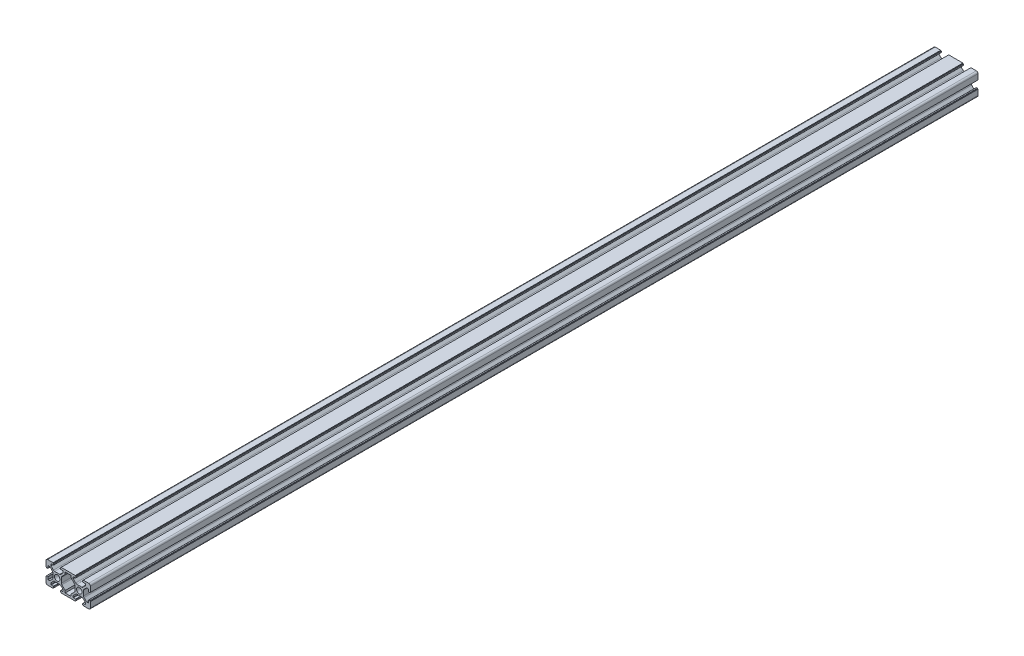
from build123d import *

# Parameters (mm, degrees)
SKETCH_1_R      = 2.5
EXTRUDE_1_DEPTH = 800


with BuildPart() as part:
    # 草图1 → 凸台-拉伸1 (new body)
    with BuildSketch(Plane.XY):
        with BuildLine():
            Line((-0.771587854, 9.545792426), (-5.671587854, 9.545792426))
            Line((-5.671587854, 9.545792426), (-5.671587854, 9.245792426))
            ThreePointArc((-5.671587854, 9.245792426), (-5.730166498, 9.10437107), (-5.871587854, 9.045792426))
            Line((-5.871587854, 9.045792426), (-6.171587854, 9.045792426))
            Line((-6.171587854, 9.045792426), (-6.171587854, 8.045792426))
            ThreePointArc((-6.171587854, 8.045792426), (-6.083719889, 7.833660392), (-5.871587854, 7.745792426))
            Line((-5.871587854, 7.745792426), (-4.071587854, 7.745792426))
            ThreePointArc((-4.071587854, 7.745792426), (-3.85945582, 7.657924461), (-3.771587854, 7.445792426))
            Line((-3.771587854, 7.445792426), (-3.771587854, 6.105792426))
            Line((-3.771587854, 6.105792426), (-5.992248026, 3.885132255))
            ThreePointArc((-5.992248026, 3.885132255), (-6.478883049, 3.559973128), (-7.052908198, 3.445792426))
            Line((-7.052908198, 3.445792426), (-11.490267511, 3.445792426))
            ThreePointArc((-11.490267511, 3.445792426), (-12.064292659, 3.559973128), (-12.550927682, 3.885132255))
            Line((-12.550927682, 3.885132255), (-14.771587854, 6.105792426))
            Line((-14.771587854, 6.105792426), (-14.771587854, 7.445792426))
            ThreePointArc((-14.771587854, 7.445792426), (-14.683719889, 7.657924461), (-14.471587854, 7.745792426))
            Line((-14.471587854, 7.745792426), (-12.671587854, 7.745792426))
            ThreePointArc((-12.671587854, 7.745792426), (-12.45945582, 7.833660392), (-12.371587854, 8.045792426))
            Line((-12.371587854, 8.045792426), (-12.371587854, 9.045792426))
            Line((-12.371587854, 9.045792426), (-12.671587854, 9.045792426))
            ThreePointArc((-12.671587854, 9.045792426), (-12.81300921, 9.10437107), (-12.871587854, 9.245792426))
            Line((-12.871587854, 9.245792426), (-12.871587854, 9.545792426))
            Line((-12.871587854, 9.545792426), (-17.771587854, 9.545792426))
            ThreePointArc((-17.771587854, 9.545792426), (-18.832248026, 9.106452598), (-19.271587854, 8.045792426))
            Line((-19.271587854, 8.045792426), (-19.271587854, 3.145792426))
            Line((-19.271587854, 3.145792426), (-18.971587854, 3.145792426))
            ThreePointArc((-18.971587854, 3.145792426), (-18.830166498, 3.087213783), (-18.771587854, 2.945792426))
            Line((-18.771587854, 2.945792426), (-18.771587854, 2.645792426))
            Line((-18.771587854, 2.645792426), (-17.771587854, 2.645792426))
            ThreePointArc((-17.771587854, 2.645792426), (-17.55945582, 2.733660392), (-17.471587854, 2.945792426))
            Line((-17.471587854, 2.945792426), (-17.471587854, 4.745792426))
            ThreePointArc((-17.471587854, 4.745792426), (-17.383719889, 4.957924461), (-17.171587854, 5.045792426))
            Line((-17.171587854, 5.045792426), (-15.831587854, 5.045792426))
            Line((-15.831587854, 5.045792426), (-13.610927682, 2.825132255))
            ThreePointArc((-13.610927682, 2.825132255), (-13.285768555, 2.338497231), (-13.171587854, 1.764472083))
            Line((-13.171587854, 1.764472083), (-13.171587854, -2.67288723))
            ThreePointArc((-13.171587854, -2.67288723), (-13.285768555, -3.246912379), (-13.610927682, -3.733547402))
            Line((-13.610927682, -3.733547402), (-15.831587854, -5.954207574))
            Line((-15.831587854, -5.954207574), (-17.171587854, -5.954207574))
            ThreePointArc((-17.171587854, -5.954207574), (-17.383719889, -5.866339608), (-17.471587854, -5.654207574))
            Line((-17.471587854, -5.654207574), (-17.471587854, -3.854207574))
            ThreePointArc((-17.471587854, -3.854207574), (-17.55945582, -3.642075539), (-17.771587854, -3.554207574))
            Line((-17.771587854, -3.554207574), (-18.771587854, -3.554207574))
            Line((-18.771587854, -3.554207574), (-18.771587854, -3.854207574))
            ThreePointArc((-18.771587854, -3.854207574), (-18.830166498, -3.99562893), (-18.971587854, -4.054207574))
            Line((-18.971587854, -4.054207574), (-19.271587854, -4.054207574))
            Line((-19.271587854, -4.054207574), (-19.271587854, -8.954207574))
            ThreePointArc((-19.271587854, -8.954207574), (-18.832248026, -10.014867745), (-17.771587854, -10.454207574))
            Line((-17.771587854, -10.454207574), (-12.871587854, -10.454207574))
            Line((-12.871587854, -10.454207574), (-12.871587854, -10.154207574))
            ThreePointArc((-12.871587854, -10.154207574), (-12.81300921, -10.012786217), (-12.671587854, -9.954207574))
            Line((-12.671587854, -9.954207574), (-12.371587854, -9.954207574))
            Line((-12.371587854, -9.954207574), (-12.371587854, -8.954207574))
            ThreePointArc((-12.371587854, -8.954207574), (-12.45945582, -8.742075539), (-12.671587854, -8.654207574))
            Line((-12.671587854, -8.654207574), (-14.471587854, -8.654207574))
            ThreePointArc((-14.471587854, -8.654207574), (-14.683719889, -8.566339608), (-14.771587854, -8.354207574))
            Line((-14.771587854, -8.354207574), (-14.771587854, -7.014207574))
            Line((-14.771587854, -7.014207574), (-12.550927682, -4.793547402))
            ThreePointArc((-12.550927682, -4.793547402), (-12.064292659, -4.468388275), (-11.490267511, -4.354207574))
            Line((-11.490267511, -4.354207574), (-7.052908198, -4.354207574))
            ThreePointArc((-7.052908198, -4.354207574), (-6.478883049, -4.468388275), (-5.992248026, -4.793547402))
            Line((-5.992248026, -4.793547402), (-3.771587854, -7.014207574))
            Line((-3.771587854, -7.014207574), (-3.771587854, -8.354207574))
            ThreePointArc((-3.771587854, -8.354207574), (-3.85945582, -8.566339608), (-4.071587854, -8.654207574))
            Line((-4.071587854, -8.654207574), (-5.871587854, -8.654207574))
            ThreePointArc((-5.871587854, -8.654207574), (-6.083719889, -8.742075539), (-6.171587854, -8.954207574))
            Line((-6.171587854, -8.954207574), (-6.171587854, -9.954207574))
            Line((-6.171587854, -9.954207574), (-5.871587854, -9.954207574))
            ThreePointArc((-5.871587854, -9.954207574), (-5.730166498, -10.012786217), (-5.671587854, -10.154207574))
            Line((-5.671587854, -10.154207574), (-5.671587854, -10.454207574))
            Line((-5.671587854, -10.454207574), (-0.771587854, -10.454207574))
            Line((-0.771587854, -10.454207574), (7.128412146, -10.454207574))
            Line((7.128412146, -10.454207574), (7.128412146, -10.154207574))
            ThreePointArc((7.128412146, -10.154207574), (7.18699079, -10.012786217), (7.328412146, -9.954207574))
            Line((7.328412146, -9.954207574), (7.628412146, -9.954207574))
            Line((7.628412146, -9.954207574), (7.628412146, -8.954207574))
            ThreePointArc((7.628412146, -8.954207574), (7.54054418, -8.742075539), (7.328412146, -8.654207574))
            Line((7.328412146, -8.654207574), (5.528412146, -8.654207574))
            ThreePointArc((5.528412146, -8.654207574), (5.316280111, -8.566339608), (5.228412146, -8.354207574))
            Line((5.228412146, -8.354207574), (5.228412146, -7.014207574))
            Line((5.228412146, -7.014207574), (7.449072318, -4.793547402))
            ThreePointArc((7.449072318, -4.793547402), (7.935707341, -4.468388275), (8.509732489, -4.354207574))
            Line((8.509732489, -4.354207574), (12.947091802, -4.354207574))
            ThreePointArc((12.947091802, -4.354207574), (13.521116951, -4.468388275), (14.007751974, -4.793547402))
            Line((14.007751974, -4.793547402), (16.228412146, -7.014207574))
            Line((16.228412146, -7.014207574), (16.228412146, -8.354207574))
            ThreePointArc((16.228412146, -8.354207574), (16.14054418, -8.566339608), (15.928412146, -8.654207574))
            Line((15.928412146, -8.654207574), (14.128412146, -8.654207574))
            ThreePointArc((14.128412146, -8.654207574), (13.916280111, -8.742075539), (13.828412146, -8.954207574))
            Line((13.828412146, -8.954207574), (13.828412146, -9.954207574))
            Line((13.828412146, -9.954207574), (14.128412146, -9.954207574))
            ThreePointArc((14.128412146, -9.954207574), (14.269833502, -10.012786217), (14.328412146, -10.154207574))
            Line((14.328412146, -10.154207574), (14.328412146, -10.454207574))
            Line((14.328412146, -10.454207574), (19.228412146, -10.454207574))
            ThreePointArc((19.228412146, -10.454207574), (20.289072318, -10.014867745), (20.728412146, -8.954207574))
            Line((20.728412146, -8.954207574), (20.728412146, -4.054207574))
            Line((20.728412146, -4.054207574), (20.428412146, -4.054207574))
            ThreePointArc((20.428412146, -4.054207574), (20.28699079, -3.99562893), (20.228412146, -3.854207574))
            Line((20.228412146, -3.854207574), (20.228412146, -3.554207574))
            Line((20.228412146, -3.554207574), (19.228412146, -3.554207574))
            ThreePointArc((19.228412146, -3.554207574), (19.016280111, -3.642075539), (18.928412146, -3.854207574))
            Line((18.928412146, -3.854207574), (18.928412146, -5.654207574))
            ThreePointArc((18.928412146, -5.654207574), (18.84054418, -5.866339608), (18.628412146, -5.954207574))
            Line((18.628412146, -5.954207574), (17.288412146, -5.954207574))
            Line((17.288412146, -5.954207574), (15.067751974, -3.733547402))
            ThreePointArc((15.067751974, -3.733547402), (14.742592847, -3.246912379), (14.628412146, -2.67288723))
            Line((14.628412146, -2.67288723), (14.628412146, 1.764472083))
            ThreePointArc((14.628412146, 1.764472083), (14.742592847, 2.338497231), (15.067751974, 2.825132255))
            Line((15.067751974, 2.825132255), (17.288412146, 5.045792426))
            Line((17.288412146, 5.045792426), (18.628412146, 5.045792426))
            ThreePointArc((18.628412146, 5.045792426), (18.84054418, 4.957924461), (18.928412146, 4.745792426))
            Line((18.928412146, 4.745792426), (18.928412146, 2.945792426))
            ThreePointArc((18.928412146, 2.945792426), (19.016280111, 2.733660392), (19.228412146, 2.645792426))
            Line((19.228412146, 2.645792426), (20.228412146, 2.645792426))
            Line((20.228412146, 2.645792426), (20.228412146, 2.945792426))
            ThreePointArc((20.228412146, 2.945792426), (20.28699079, 3.087213783), (20.428412146, 3.145792426))
            Line((20.428412146, 3.145792426), (20.728412146, 3.145792426))
            Line((20.728412146, 3.145792426), (20.728412146, 8.045792426))
            ThreePointArc((20.728412146, 8.045792426), (20.289072318, 9.106452598), (19.228412146, 9.545792426))
            Line((19.228412146, 9.545792426), (14.328412146, 9.545792426))
            Line((14.328412146, 9.545792426), (14.328412146, 9.245792426))
            ThreePointArc((14.328412146, 9.245792426), (14.269833502, 9.10437107), (14.128412146, 9.045792426))
            Line((14.128412146, 9.045792426), (13.828412146, 9.045792426))
            Line((13.828412146, 9.045792426), (13.828412146, 8.045792426))
            ThreePointArc((13.828412146, 8.045792426), (13.916280111, 7.833660392), (14.128412146, 7.745792426))
            Line((14.128412146, 7.745792426), (15.928412146, 7.745792426))
            ThreePointArc((15.928412146, 7.745792426), (16.14054418, 7.657924461), (16.228412146, 7.445792426))
            Line((16.228412146, 7.445792426), (16.228412146, 6.105792426))
            Line((16.228412146, 6.105792426), (14.007751974, 3.885132255))
            ThreePointArc((14.007751974, 3.885132255), (13.521116951, 3.559973128), (12.947091802, 3.445792426))
            Line((12.947091802, 3.445792426), (8.509732489, 3.445792426))
            ThreePointArc((8.509732489, 3.445792426), (7.935707341, 3.559973128), (7.449072318, 3.885132255))
            Line((7.449072318, 3.885132255), (5.228412146, 6.105792426))
            Line((5.228412146, 6.105792426), (5.228412146, 7.445792426))
            ThreePointArc((5.228412146, 7.445792426), (5.316280111, 7.657924461), (5.528412146, 7.745792426))
            Line((5.528412146, 7.745792426), (7.328412146, 7.745792426))
            ThreePointArc((7.328412146, 7.745792426), (7.54054418, 7.833660392), (7.628412146, 8.045792426))
            Line((7.628412146, 8.045792426), (7.628412146, 9.045792426))
            Line((7.628412146, 9.045792426), (7.328412146, 9.045792426))
            ThreePointArc((7.328412146, 9.045792426), (7.18699079, 9.10437107), (7.128412146, 9.245792426))
            Line((7.128412146, 9.245792426), (7.128412146, 9.545792426))
            Line((7.128412146, 9.545792426), (2.228412146, 9.545792426))
            Line((2.228412146, 9.545792426), (-0.771587854, 9.545792426))
        make_face()
        with Locations((10.728412146, -0.454207574)):
            Circle(SKETCH_1_R, mode=Mode.SUBTRACT)
        with Locations((-9.271587854, -0.454207574)):
            Circle(SKETCH_1_R, mode=Mode.SUBTRACT)
        with BuildLine():
            Line((-1.971587854, -6.694207574), (-4.932248026, -3.733547402))
            ThreePointArc((-4.932248026, -3.733547402), (-5.257407153, -3.246912379), (-5.371587854, -2.67288723))
            Line((-5.371587854, -2.67288723), (-5.371587854, 1.764472083))
            ThreePointArc((-5.371587854, 1.764472083), (-5.257407153, 2.338497231), (-4.932248026, 2.825132255))
            Line((-4.932248026, 2.825132255), (-1.971587854, 5.785792426))
            Line((-1.971587854, 5.785792426), (-1.971587854, 7.745792426))
            Line((-1.971587854, 7.745792426), (3.428412146, 7.745792426))
            Line((3.428412146, 7.745792426), (3.428412146, 5.785792426))
            Line((3.428412146, 5.785792426), (6.389072318, 2.825132255))
            ThreePointArc((6.389072318, 2.825132255), (6.714231445, 2.338497231), (6.828412146, 1.764472083))
            Line((6.828412146, 1.764472083), (6.828412146, -2.67288723))
            ThreePointArc((6.828412146, -2.67288723), (6.714231445, -3.246912379), (6.389072318, -3.733547402))
            Line((6.389072318, -3.733547402), (3.428412146, -6.694207574))
            Line((3.428412146, -6.694207574), (3.428412146, -8.654207574))
            Line((3.428412146, -8.654207574), (-1.971587854, -8.654207574))
            Line((-1.971587854, -8.654207574), (-1.971587854, -6.694207574))
        make_face(mode=Mode.SUBTRACT)
    extrude(amount=EXTRUDE_1_DEPTH)


solid = part.part
